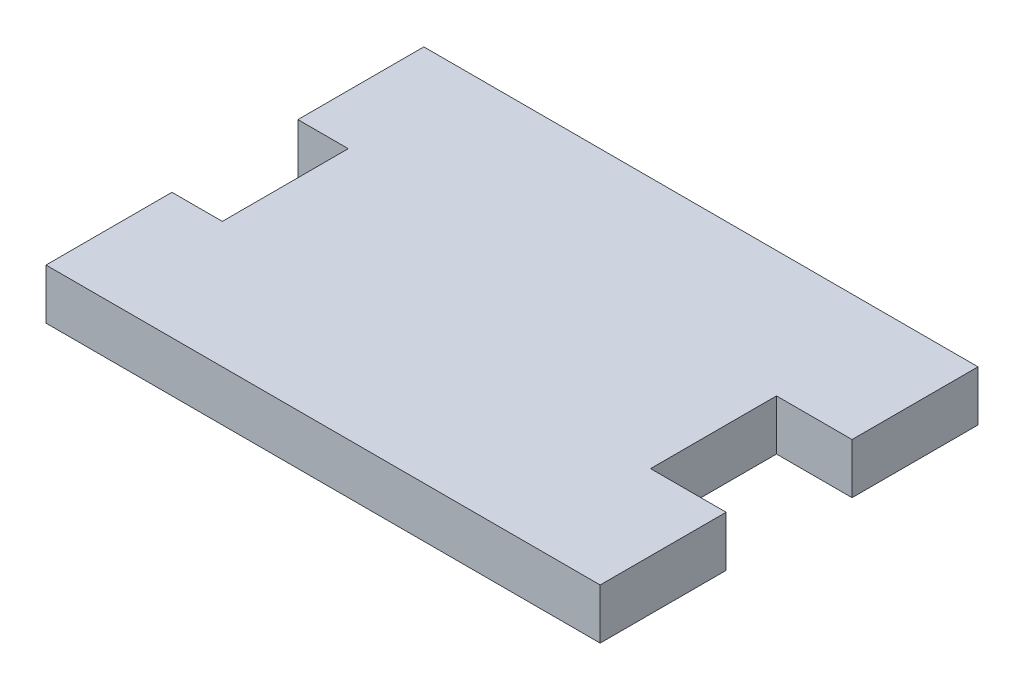
from build123d import *

# Parameters (mm, degrees)
SKETCH1_W           = 22
SKETCH1_H           = 15
BOSS_EXTRUDE1_DEPTH = 2
SKETCH2_W           = 2
SKETCH2_H           = 5
SKETCH2_W_2         = 3
CUT_EXTRUDE1_DEPTH  = 2


with BuildPart() as part:
    # Sketch1 → Boss-Extrude1 (new body)
    with BuildSketch(Plane(origin=(0, 0, 0), x_dir=(1, 0, 0), z_dir=(0, 1, 0))):
        Rectangle(SKETCH1_W, SKETCH1_H)
    extrude(amount=BOSS_EXTRUDE1_DEPTH)

    # Sketch2 → Cut-Extrude1 (cut)
    with BuildSketch(Plane(origin=(0, 2, 0), x_dir=(1, 0, 0), z_dir=(0, 1, 0))):
        with Locations((-10, 0)):
            Rectangle(SKETCH2_W, SKETCH2_H)
        with Locations((9.5, 0)):
            Rectangle(SKETCH2_W_2, SKETCH2_H)
    extrude(amount=-CUT_EXTRUDE1_DEPTH, mode=Mode.SUBTRACT)


solid = part.part
